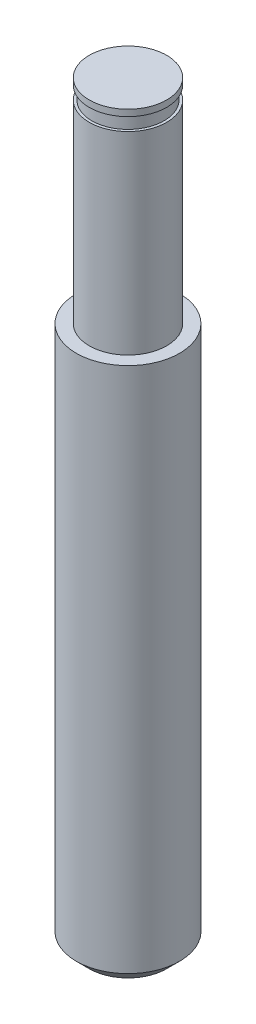
from build123d import *

# Parameters (mm, degrees)
CHAMFER1_SIZE = 1


with BuildPart() as part:
    # Sketch1 → Revolve1 (revolve)
    with BuildSketch(Plane.XY, mode=Mode.PRIVATE) as revolve1_sk:
        Polygon((0, 29.15), (3, 29.15), (3, 28.65), (2.8, 28.65), (2.8, 27.65), (3, 27.65), (3, 12.65), (4, 12.65), (4, -29.15), (0, -29.15), align=None)
    revolve(revolve1_sk.sketch.rotate(Axis((0, 29.15, 0), (0, -1, 0)), 90), axis=Axis((0, 29.15, 0), (0, -1, 0)))

    # Chamfer1
    chamfer1_edges = [part.edges().sort_by_distance(p)[0] for p in [
        (0, -29.15, -4),
    ]]
    chamfer(chamfer1_edges, length=CHAMFER1_SIZE)


solid = part.part
